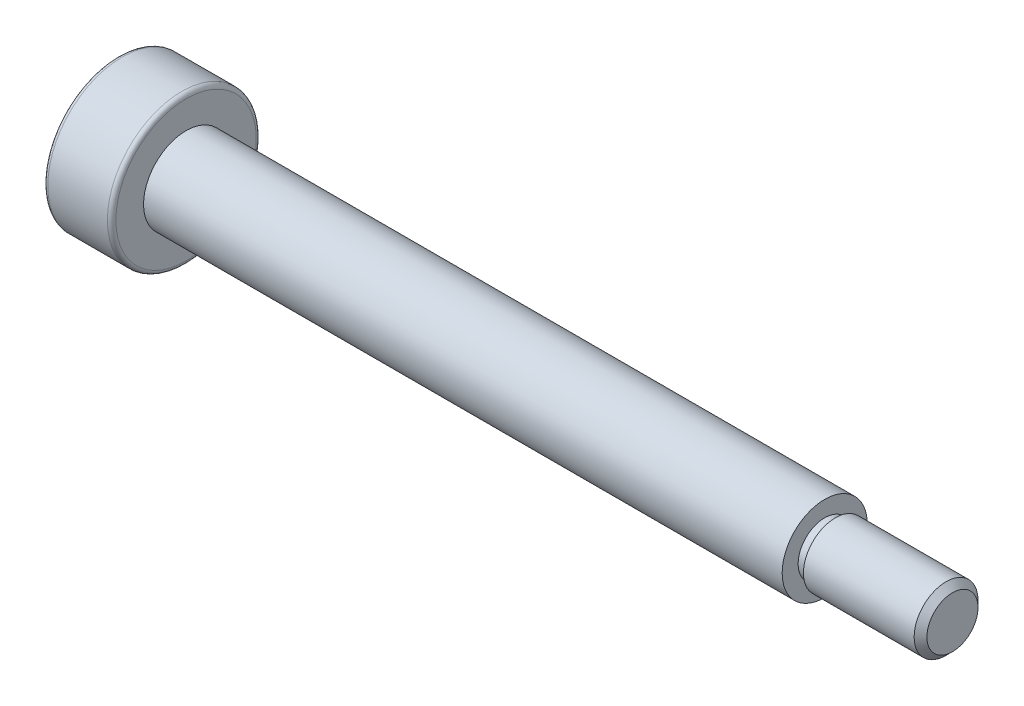
from build123d import *

# Parameters (mm, degrees)
FILLET_1_R          = 0.2
CHAMFER_1_SIZE      = 0.3
SKETCH_3_W          = 0.5
SKETCH_3_H          = 0.25
CUT_EXTRUDE_1_DEPTH = 2


with BuildPart() as part:
    # 草图1 → 旋转1 (revolve)
    with BuildSketch(Plane.XY, mode=Mode.PRIVATE) as revolve_1_sk:
        Polygon((-19.6, 0), (-19.6, 3.5), (-16.4, 3.5), (-16.4, 2), (13.6, 2), (13.6, 1.5), (19.6, 1.5), (19.6, 0), align=None)
    revolve(revolve_1_sk.sketch.rotate(Axis((-19.6, 0, 0), (1, 0, 0)), 90), axis=Axis((-19.6, 0, 0), (1, 0, 0)))

    # 圆角1
    fillet_1_edges = [part.edges().sort_by_distance(p)[0] for p in [
        (-16.4, 0, -3.5),
        (-19.6, 0, -3.5),
    ]]
    fillet(fillet_1_edges, radius=FILLET_1_R)

    # 倒角1
    chamfer_1_edges = [part.edges().sort_by_distance(p)[0] for p in [
        (19.6, 0, -1.5),
    ]]
    chamfer(chamfer_1_edges, length=CHAMFER_1_SIZE)

    # 草图3 → 切除-旋转1 (revolve, cut)
    with BuildSketch(Plane.XY, mode=Mode.PRIVATE) as cut_revolve_1_sk:
        with Locations((13.85, 1.375)):
            Rectangle(SKETCH_3_W, SKETCH_3_H)
    revolve(cut_revolve_1_sk.sketch.rotate(Axis((13.6, 0, 0), (1, 0, 0)), 90), axis=Axis((13.6, 0, 0), (1, 0, 0)), mode=Mode.SUBTRACT)

    # 草图4 → 切除-拉伸1 (cut)
    with BuildSketch(Plane.ZY.offset(19.6)):
        Polygon((1.732050808, 0), (0.866025404, 1.5), (-0.866025404, 1.5), (-1.732050808, 0), (-0.866025404, -1.5), (0.866025404, -1.5), align=None)
    extrude(amount=-CUT_EXTRUDE_1_DEPTH, mode=Mode.SUBTRACT)


solid = part.part
